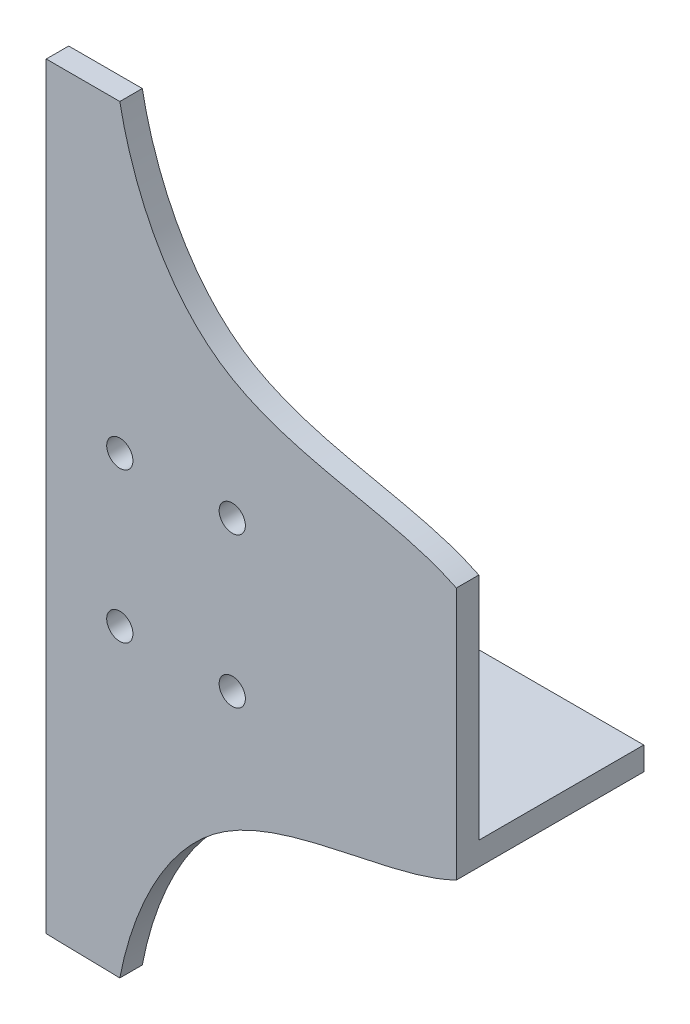
from build123d import *

# Parameters (mm, degrees)
SKETCH3_R           = 1.75
BOSS_EXTRUDE2_DEPTH = 3
SKETCH4_W           = 54.71275589
SKETCH4_H           = 3.111536519
BOSS_EXTRUDE3_DEPTH = 22


with BuildPart() as part:
    # Sketch3 → Boss-Extrude2 (new body)
    with BuildSketch(Plane.XY):
        with BuildLine():
            Line((0.033369184, 50.631957294), (0.033369184, -50.424600046))
            Line((0.033369184, -50.424600046), (9.85, -50.631957294))
            add(Edge.make_bspline(
                [(54.746125074, -16.873198091), (45.78853614, -21.288615011), (21.037768937, -20.539930575), (11.485294324, -41.9878824), (9.85, -50.631957294)],
                knots=[0, 0, 0, 0, 0.5491041, 1, 1, 1, 1], degree=3))
            Line((54.746125074, -16.873198091), (54.746125074, 16.873198091))
            add(Edge.make_bspline(
                [(54.746125074, 16.873198091), (45.78853614, 21.288615011), (21.037768937, 20.539930575), (11.485294324, 41.9878824), (9.85, 50.631957294)],
                knots=[0, 0, 0, 0, 0.5491041, 1, 1, 1, 1], degree=3))
            Line((9.85, 50.631957294), (0.033369184, 50.631957294))
        make_face()
        with Locations((9.85, 10)):
            Circle(SKETCH3_R, mode=Mode.SUBTRACT)
        with Locations((24.85, 10)):
            Circle(SKETCH3_R, mode=Mode.SUBTRACT)
        with Locations((24.85, -10)):
            Circle(SKETCH3_R, mode=Mode.SUBTRACT)
        with Locations((9.85, -10)):
            Circle(SKETCH3_R, mode=Mode.SUBTRACT)
    extrude(amount=BOSS_EXTRUDE2_DEPTH)

    # Sketch4 → Boss-Extrude3 (add)
    with BuildSketch(Plane(origin=(0, 0, 0), x_dir=(-1, 0, 0), z_dir=(0, 0, -1))):
        with Locations((-27.389747129, -15.317429832)):
            Rectangle(SKETCH4_W, SKETCH4_H)
    extrude(amount=BOSS_EXTRUDE3_DEPTH)


solid = part.part
